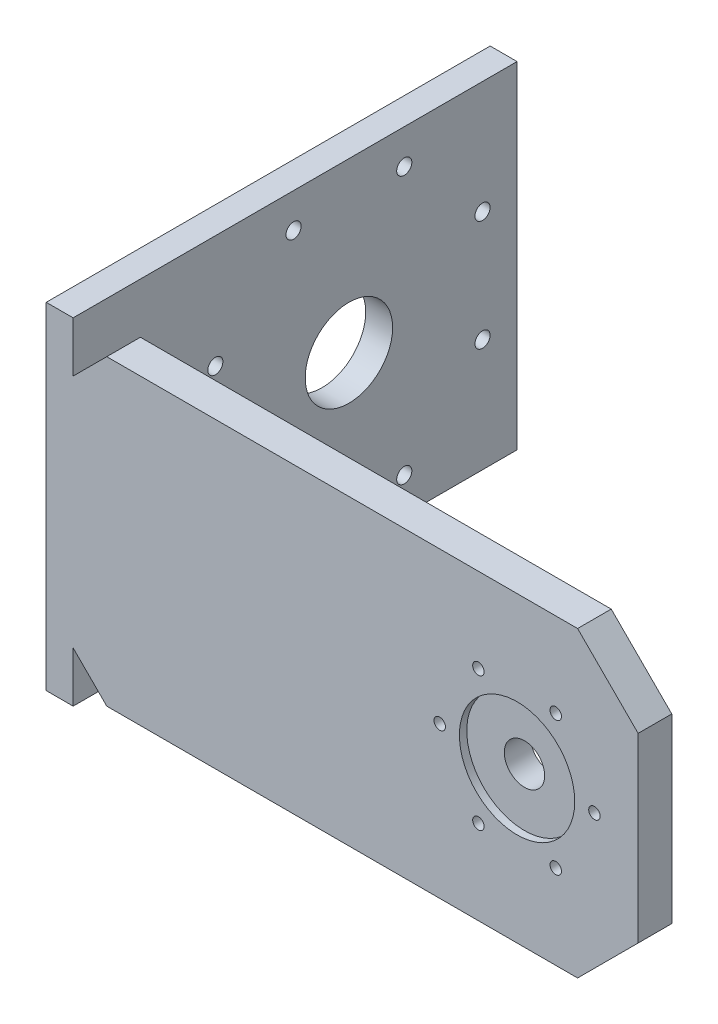
from build123d import *

# Parameters (mm, degrees)
SK_TOP_PLATE_R         = 1.7
SK_TOP_PLATE_R_2       = 6
TOP_PLATE_DEPTH        = 10
SK_YAW_PILOT_RECESS_R  = 17.15
YAW_PILOT_RECESS_DEPTH = 2.2
SK_BACK_PLATE_W        = 132
SK_BACK_PLATE_H        = 100
SK_BACK_PLATE_R        = 2.25
SK_BACK_PLATE_R_2      = 13
BACK_PLATE_DEPTH       = 8
RIB_DEPTH              = 8


with BuildPart() as part:
    # SK_Top_Plate → Top_Plate (new body)
    with BuildSketch(Plane.XY.offset(72)):
        Polygon((-122, 45), (18, 45), (36, 27), (36, -27), (18, -45), (-122, -45), (-140, -27), (-140, 27), align=None)
        with Locations((23, 0)):
            Circle(SK_TOP_PLATE_R, mode=Mode.SUBTRACT)
        with Locations((11.5, -19.918584287)):
            Circle(SK_TOP_PLATE_R, mode=Mode.SUBTRACT)
        with Locations((-11.5, -19.918584287)):
            Circle(SK_TOP_PLATE_R, mode=Mode.SUBTRACT)
        with Locations((-23, 0)):
            Circle(SK_TOP_PLATE_R, mode=Mode.SUBTRACT)
        with Locations((-11.5, 19.918584287)):
            Circle(SK_TOP_PLATE_R, mode=Mode.SUBTRACT)
        with Locations((11.5, 19.918584287)):
            Circle(SK_TOP_PLATE_R, mode=Mode.SUBTRACT)
        Circle(SK_TOP_PLATE_R_2, mode=Mode.SUBTRACT)
    extrude(amount=TOP_PLATE_DEPTH)

    # SK_Yaw_Pilot_Recess → Yaw_Pilot_Recess (cut)
    with BuildSketch(Plane.XY.offset(82)):
        Circle(SK_YAW_PILOT_RECESS_R)
    extrude(amount=-YAW_PILOT_RECESS_DEPTH, mode=Mode.SUBTRACT)

    # SK_Back_Plate → Back_Plate (add)
    with BuildSketch(Plane(origin=(-140, 0, 0), x_dir=(0, 0, -1), z_dir=(1, 0, 0))):
        with Locations((-16, 0)):
            Rectangle(SK_BACK_PLATE_W, SK_BACK_PLATE_H)
        with Locations((39.726819898, -16.455387592)):
            Circle(SK_BACK_PLATE_R, mode=Mode.SUBTRACT)
        with Locations((16.455387592, -39.726819898)):
            Circle(SK_BACK_PLATE_R, mode=Mode.SUBTRACT)
        with Locations((-16.455387592, -39.726819898)):
            Circle(SK_BACK_PLATE_R, mode=Mode.SUBTRACT)
        with Locations((-39.726819898, -16.455387592)):
            Circle(SK_BACK_PLATE_R, mode=Mode.SUBTRACT)
        with Locations((-39.726819898, 16.455387592)):
            Circle(SK_BACK_PLATE_R, mode=Mode.SUBTRACT)
        with Locations((-16.455387592, 39.726819898)):
            Circle(SK_BACK_PLATE_R, mode=Mode.SUBTRACT)
        with Locations((16.455387592, 39.726819898)):
            Circle(SK_BACK_PLATE_R, mode=Mode.SUBTRACT)
        with Locations((39.726819898, 16.455387592)):
            Circle(SK_BACK_PLATE_R, mode=Mode.SUBTRACT)
        Circle(SK_BACK_PLATE_R_2, mode=Mode.SUBTRACT)
    extrude(amount=BACK_PLATE_DEPTH)

    # SK_Rib → Rib (add)
    with BuildSketch(Plane(origin=(0, -4, 0), x_dir=(1, 0, 0), z_dir=(0, 1, 0))):
        Polygon((-140, -52), (-30, -72), (-140, -72), align=None)
    extrude(amount=RIB_DEPTH)


solid = part.part
